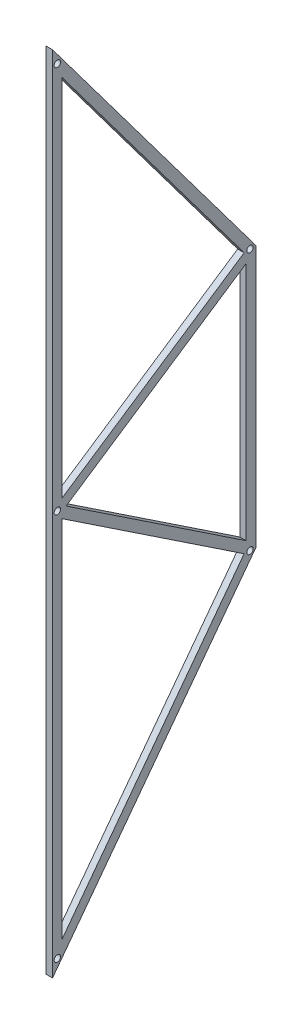
from build123d import *

# Parameters (mm, degrees)
BOSS_EXTRUDE2_DEPTH = 10
SKETCH6_R           = 5
CUT_EXTRUDE3_DEPTH  = 10


with BuildPart() as part:
    # Sketch4 → Boss-Extrude2 (new body)
    with BuildSketch(Plane.YZ):
        Polygon((-185.986121811, -292.5), (-190.986121811, -300), (190.986121811, -300), (185.986121811, -292.5), align=None)
        Polygon((600, 0), (9.013878189, 0), (14.013878189, -7.5), (577.5, -7.5), (201.842585459, -289.243060906), (197.5, -292.5), (195, -292.5), (200, -300), align=None)
        Polygon((-200, -300), (-600, 0), (-9.013878189, 0), (0, 0), (9.013878189, 0), (600, 0), (200, -300), (190.986121811, -300), (195.986121811, -307.5), (202.5, -307.5), (622.5, 7.5), (-622.5, 7.5), (-202.5, -307.5), (-195.986121811, -307.5), (-190.986121811, -300), align=None)
        Polygon((-9.013878189, 0), (-600, 0), (-200, -300), (-195, -292.5), (-197.5, -292.5), (-201.842585459, -289.243060906), (-577.5, -7.5), (-14.013878189, -7.5), align=None)
        Polygon((-5, -7.5), (-14.013878189, -7.5), (-201.842585459, -289.243060906), (-197.5, -292.5), (-195, -292.5), align=None)
        Polygon((-5, -7.5), (-195, -292.5), (-185.986121811, -292.5), (0, -13.520817283), (185.986121811, -292.5), (195, -292.5), (5, -7.5), align=None)
        Polygon((-195, -292.5), (-200, -300), (-190.986121811, -300), (-185.986121811, -292.5), align=None)
        Polygon((190.986121811, -300), (-190.986121811, -300), (-195.986121811, -307.5), (195.986121811, -307.5), align=None)
        Polygon((14.013878189, -7.5), (5, -7.5), (195, -292.5), (197.5, -292.5), (201.842585459, -289.243060906), align=None)
        Polygon((185.986121811, -292.5), (190.986121811, -300), (200, -300), (195, -292.5), align=None)
        Polygon((0, 0), (-9.013878189, 0), (-14.013878189, -7.5), (-5, -7.5), align=None)
        Polygon((9.013878189, 0), (0, 0), (5, -7.5), (14.013878189, -7.5), align=None)
        Polygon((5, -7.5), (0, 0), (-5, -7.5), align=None)
    extrude(amount=BOSS_EXTRUDE2_DEPTH)

    # Sketch6 → Cut-Extrude3 (cut)
    with BuildSketch(Plane.YZ.offset(10)):
        with Locations(Location((0, 0, 0), (0, 0, 270))):
            Circle(SKETCH6_R)
        with Locations(Location((-600, 0, 0), (0, 0, 270))):
            Circle(SKETCH6_R)
        with Locations(Location((-202.274610117, -298.294042412, 0), (0, 0, 270))):
            Circle(SKETCH6_R)
        with Locations(Location((202.274610117, -298.294042412, 0), (0, 0, 270))):
            Circle(SKETCH6_R)
        with Locations(Location((600, 0, 0), (0, 0, 270))):
            Circle(SKETCH6_R)
    extrude(amount=-CUT_EXTRUDE3_DEPTH, mode=Mode.SUBTRACT)


solid = part.part
